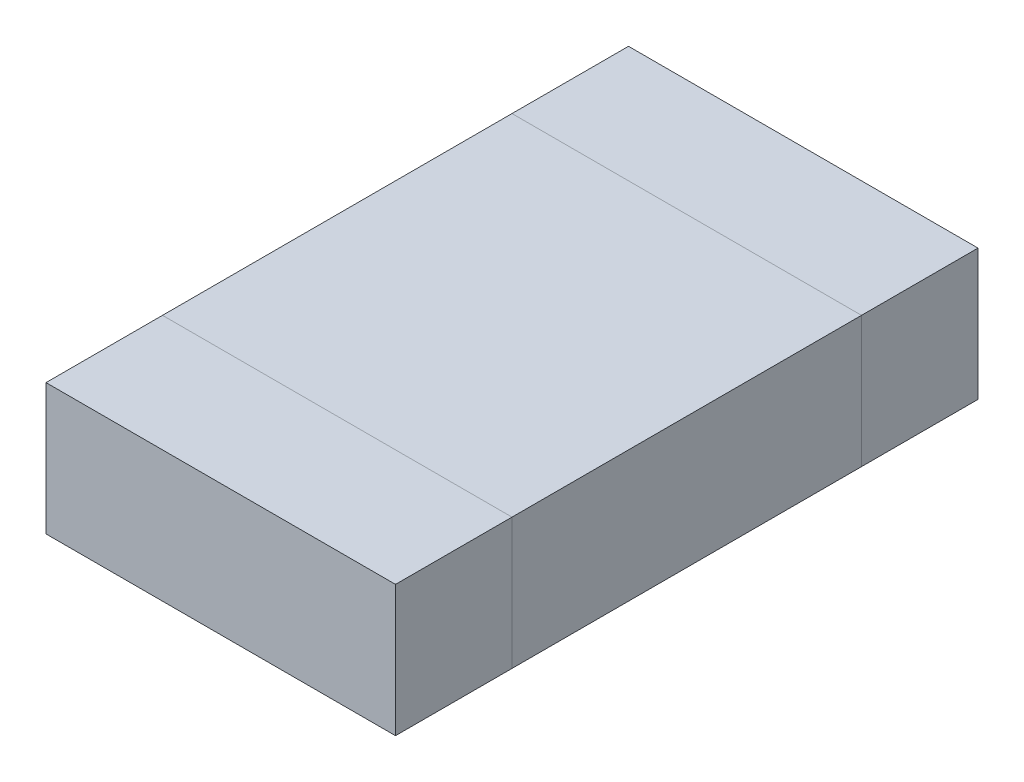
from build123d import *

# Parameters (mm, degrees)
MAINBODYS_W     = 1.2
MAINBODYS_H     = 1.2
MAINBODY_DEPTH  = 0.45
LEFTBODYS_W     = 1.2
LEFTBODYS_H     = 0.4
LEFTBODY_DEPTH  = 0.45
RIGHTBODYS_W    = 1.2
RIGHTBODYS_H    = 0.4
RIGHTBODY_DEPTH = 0.45


with BuildPart() as part:
    # MainBodyS → MainBody (new body)
    with BuildSketch(Plane(origin=(0, 0, 0), x_dir=(1, 0, 0), z_dir=(0, 1, 0))):
        Rectangle(MAINBODYS_W, MAINBODYS_H)
    extrude(amount=MAINBODY_DEPTH)


with BuildPart() as body_2:
    # LeftBodyS → LeftBody (new body)
    with BuildSketch(Plane(origin=(0, 0, 0), x_dir=(-1, 0, 0), z_dir=(0, -1, 0))):
        with Locations((0, -0.8)):
            Rectangle(LEFTBODYS_W, LEFTBODYS_H)
    extrude(amount=-LEFTBODY_DEPTH)


with BuildPart() as body_3:
    # RightBodyS → RightBody (new body)
    with BuildSketch(Plane.XZ):
        with Locations((0, -0.8)):
            Rectangle(RIGHTBODYS_W, RIGHTBODYS_H)
    extrude(amount=-RIGHTBODY_DEPTH)


solid = Compound([part.part, body_2.part, body_3.part])
